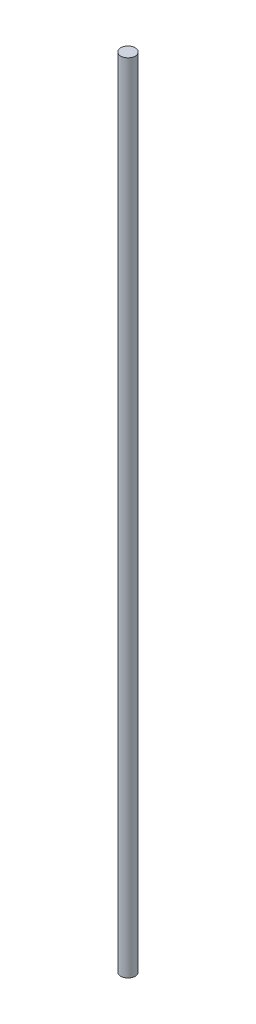
from build123d import *

# Parameters (mm, degrees)
SKETCH1_R           = 2
BOSS_EXTRUDE2_DEPTH = 220


with BuildPart() as part:
    # Sketch1 → Boss-Extrude2 (new body)
    with BuildSketch(Plane(origin=(0, 0, 0), x_dir=(1, 0, 0), z_dir=(0, 1, 0))):
        with Locations(Location((0, 0, 0), (0, 0, 270))):
            Circle(SKETCH1_R)
    extrude(amount=BOSS_EXTRUDE2_DEPTH)


solid = part.part
